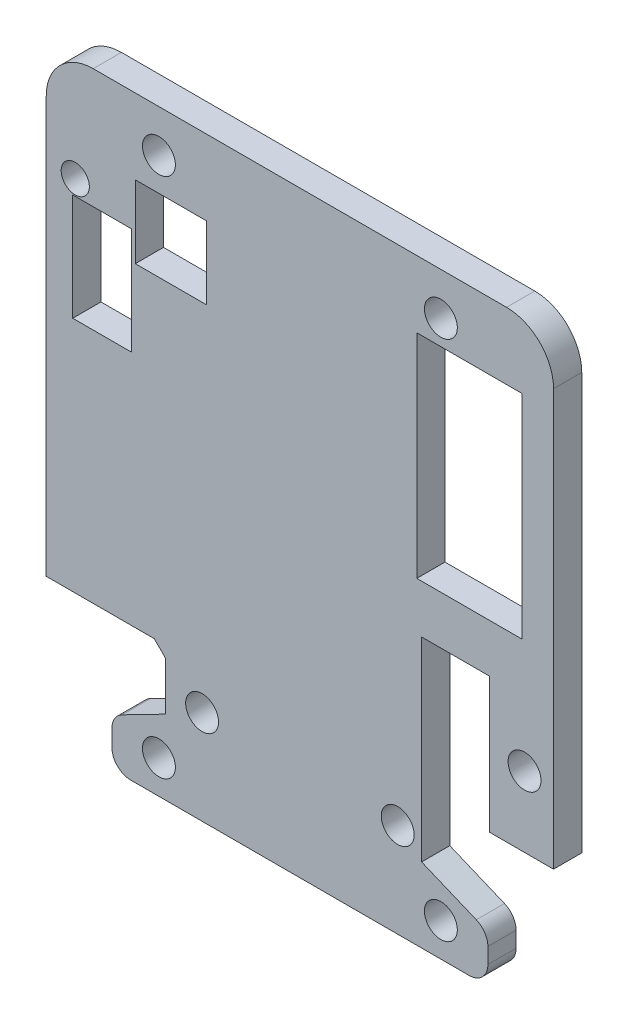
from build123d import *

# Parameters (mm, degrees)
SKETCH2_R           = 1.75
SKETCH2_R_2         = 1.5
SKETCH2_W           = 6.259541377
SKETCH2_H           = 11.363852943
BOSS_EXTRUDE1_DEPTH = 3
SKETCH3_R           = 1.75
BOSS_EXTRUDE2_DEPTH = 3


with BuildPart() as part:
    # Sketch2 → Boss-Extrude1 (new body)
    with BuildSketch(Plane(origin=(0, 0, 0), x_dir=(-1, 0, 0), z_dir=(0, 0, -1))):
        Polygon((-11.441133476, 47.916141751), (-14.819831639, 47.916141751), (-14.819831639, 6.641141751), (-7.995621622, 6.641141751), (-7.995621622, 21.022330273), (-0.780778634, 21.022330273), (-0.780778634, 0.291141751), (26.455168361, 0.291141751), (26.455168361, 5.428807174), (27.667502938, 6.641141751), (39.155168361, 6.641141751), (39.155168361, 47.916141751), (29.679646442, 47.916141751), (29.679646442, 40.185572696), (22.120281557, 40.185572696), (22.120281557, 47.916141751), (-0.269040639, 47.916141751), (-0.269040639, 26.164281213), (-11.441133476, 26.164281213), align=None)
        with Locations((1.761418361, 2.378641751)):
            Circle(SKETCH2_R, mode=Mode.SUBTRACT)
        with Locations((36.067668361, 44.828641751)):
            Circle(SKETCH2_R_2, mode=Mode.SUBTRACT)
        with Locations((22.573918361, 2.378641751)):
            Circle(SKETCH2_R, mode=Mode.SUBTRACT)
        with Locations((-11.732331639, 14.141141751)):
            Circle(SKETCH2_R, mode=Mode.SUBTRACT)
        with Locations((33.207620521, 37.511488804)):
            Rectangle(SKETCH2_W, SKETCH2_H, mode=Mode.SUBTRACT)
    extrude(amount=-BOSS_EXTRUDE1_DEPTH)

    # Sketch3 → Boss-Extrude2 (add)
    # profile 1 of 2: a face of its own
    with BuildSketch(Plane.XY):
        with BuildLine():
            Line((-39.155168361, 47.916141751), (0.269040639, 47.916141751))
            Line((0.269040639, 47.916141751), (0.269040639, 48.797882205))
            Line((0.269040639, 48.797882205), (11.441133476, 48.797882205))
            Line((11.441133476, 48.797882205), (11.441133476, 47.916141751))
            Line((11.441133476, 47.916141751), (14.819831639, 47.916141751))
            Line((14.819831639, 47.916141751), (14.819831639, 50.916141751))
            ThreePointArc((14.819831639, 50.916141751), (13.355365545, 54.451675657), (9.819831639, 55.916141751))
            Line((9.819831639, 55.916141751), (-34.155168361, 55.916141751))
            ThreePointArc((-34.155168361, 55.916141751), (-37.690702267, 54.451675657), (-39.155168361, 50.916141751))
            Line((-39.155168361, 50.916141751), (-39.155168361, 47.916141751))
        make_face()
        with Locations((-27.167668361, 51.416141751)):
            Circle(SKETCH3_R, mode=Mode.SUBTRACT)
        with Locations((2.832331639, 51.416141751)):
            Circle(SKETCH3_R, mode=Mode.SUBTRACT)
    # profile 2 of 2: a face of its own
    with BuildSketch(Plane.XY):
        with BuildLine():
            Line((-26.455168361, 0.291141751), (-31.080954927, -2.083201693))
            ThreePointArc((-31.080954927, -2.083201693), (-31.87450361, -2.820045974), (-32.167668361, -3.862501457))
            Line((-32.167668361, -3.862501457), (-32.167668361, -5.640994596))
            ThreePointArc((-32.167668361, -5.640994596), (-31.581881924, -7.055208159), (-30.167668361, -7.640994596))
            Line((-30.167668361, -7.640994596), (5.832331639, -7.640994596))
            ThreePointArc((5.832331639, -7.640994596), (7.246545201, -7.055208159), (7.832331639, -5.640994596))
            Line((7.832331639, -5.640994596), (7.832331639, -3.975377608))
            ThreePointArc((7.832331639, -3.975377608), (7.496029114, -2.865372784), (6.600220929, -2.128665384))
            Line((6.600220929, -2.128665384), (0.780778634, 0.291141751))
            Line((0.780778634, 0.291141751), (-26.455168361, 0.291141751))
        make_face()
        with Locations((-27.167668361, -4.083858249)):
            Circle(SKETCH3_R, mode=Mode.SUBTRACT)
        with Locations((2.832331639, -4.083858249)):
            Circle(SKETCH3_R, mode=Mode.SUBTRACT)
    extrude(amount=BOSS_EXTRUDE2_DEPTH)


solid = part.part
